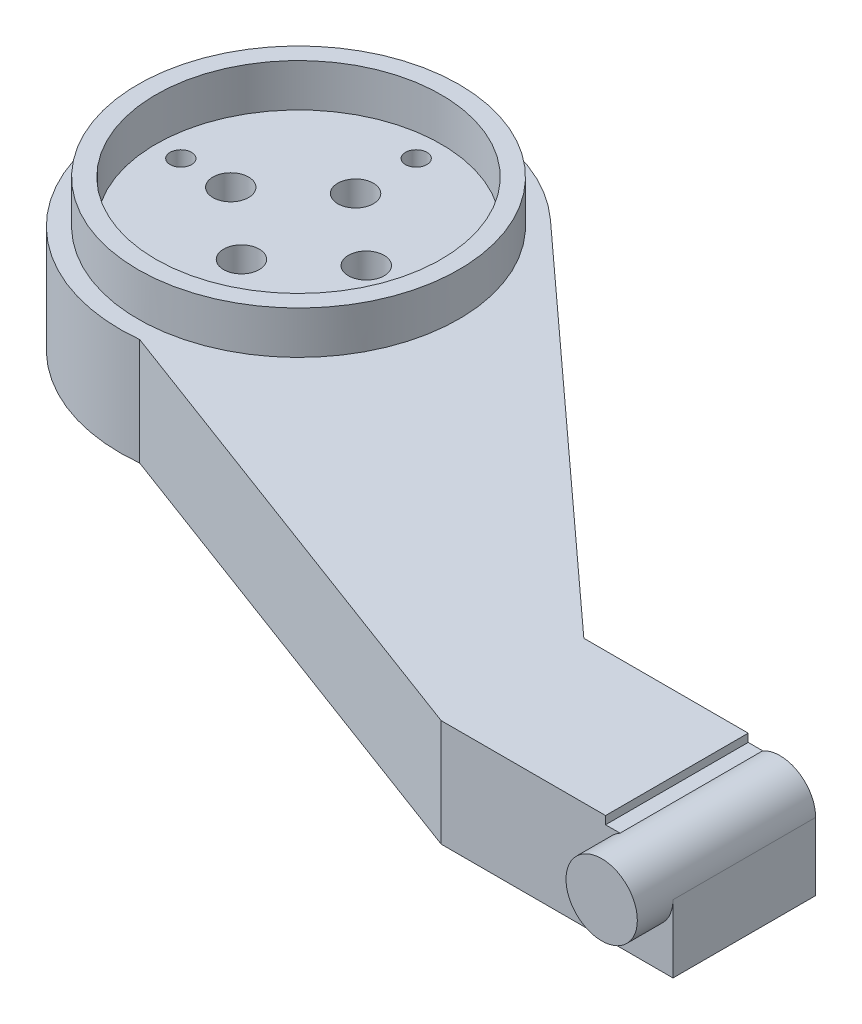
from build123d import *

# Parameters (mm, degrees)
EXTRUDE_1_DEPTH           = 10
EXTRUDE_1_DEPTH_BACK      = 5
SKETCH_1_W                = 35
SKETCH_1_H                = 20
SKETCH_17_R               = 5
EXTRUDE_3_DEPTH           = 5
SKETCH_7_R                = 3
CUT_EXTRUDE_7_DEPTH       = 5
CUT_EXTRUDE_12_DEPTH      = 26.124689053
CUT_EXTRUDE_12_DEPTH_BACK = 26.124689053
EXTRUDE_2_DEPTH           = 15
SKETCH_19_R               = 22.5
SKETCH_19_R_2             = 20
EXTRUDE_4_DEPTH           = 6
SKETCH_20_R               = 2.5
SKETCH_20_R_2             = 1.5
CUT_EXTRUDE_16_DEPTH      = 6


with BuildPart() as part:
    # 草圖1 → 填料-伸長1 (new, two sides: drawn at the far end of the back side and taken through both)
    with BuildSketch(Plane(origin=(0, 0, 0), x_dir=(1, 0, 0), z_dir=(0, 1, 0)).offset(-EXTRUDE_1_DEPTH_BACK)):
        Rectangle(SKETCH_1_W, SKETCH_1_H)
    extrude(amount=EXTRUDE_1_DEPTH + EXTRUDE_1_DEPTH_BACK)

    # 草圖17 → 填料-伸長3 (add)
    with BuildSketch(Plane.XY.offset(10)):
        with Locations((10, 4.5)):
            Circle(SKETCH_17_R)
    extrude(amount=EXTRUDE_3_DEPTH)

    # 草圖7 → 除料-伸長7 (cut, symmetric)
    with BuildSketch(Plane.XY.offset(-10)):
        with Locations((10, 4.5)):
            Circle(SKETCH_7_R)
    extrude(amount=CUT_EXTRUDE_7_DEPTH, both=True, mode=Mode.SUBTRACT)

    # 草圖12 → 除料-伸長12 (cut, two sides: drawn at the far end of the back side and taken through both)
    with BuildSketch(Plane.XY.offset(-CUT_EXTRUDE_12_DEPTH_BACK)):
        with BuildLine():
            Line((15, 4.5), (15, -5))
            Line((15, -5), (17.54652099, -5))
            Line((17.54652099, -5), (17.54652099, 10.497831093))
            Line((17.54652099, 10.497831093), (5.54652099, 10.497831093))
            Line((5.54652099, 10.497831093), (5.54652099, 8.8762607))
            Line((5.54652099, 8.8762607), (7.581665389, 8.8762607))
            ThreePointArc((7.581665389, 8.8762607), (12.540504571, 8.806487725), (15, 4.5))
        make_face()
    extrude(amount=CUT_EXTRUDE_12_DEPTH + CUT_EXTRUDE_12_DEPTH_BACK, mode=Mode.SUBTRACT)

    # 草圖14 → 填料-伸長2 (add)
    with BuildSketch(Plane(origin=(0, -5, 0), x_dir=(1, 0, 0), z_dir=(0, 1, 0))):
        with BuildLine():
            Line((-17.5, 10), (-70.654637132, 58.47251336))
            ThreePointArc((-70.654637132, 58.47251336), (-111.24926813, 47.808473813), (-84.903421397, 15.135210044))
            Line((-84.903421397, 15.135210044), (-17.5, -10))
            Line((-17.5, -10), (-17.5, 10))
        make_face()
    extrude(amount=EXTRUDE_2_DEPTH)

    # 草圖19 → 填料-伸長4 (add)
    with BuildSketch(Plane(origin=(0, 10, 0), x_dir=(1, 0, 0), z_dir=(0, 1, 0))):
        with Locations(Location((-87.5, 40, 0), (0, 0, 90))):
            Circle(SKETCH_19_R)
        with Locations(Location((-87.5, 40, 0), (0, 0, 270))):
            Circle(SKETCH_19_R_2, mode=Mode.SUBTRACT)
    extrude(amount=EXTRUDE_4_DEPTH)

    # 草圖20 → 除料-伸長16 (cut)
    with BuildSketch(Plane(origin=(0, 10, 0), x_dir=(1, 0, 0), z_dir=(0, 1, 0))):
        with Locations(Location((-87.5, 48, 0), (0, 0, 270))):
            Circle(SKETCH_20_R)
        with Locations(Location((-87.5, 56.5, 0), (0, 0, 270))):
            Circle(SKETCH_20_R_2)
        with Locations(Location((-97, 40, 0), (0, 0, 270))):
            Circle(SKETCH_20_R)
        with Locations(Location((-104, 40, 0), (0, 0, 270))):
            Circle(SKETCH_20_R_2)
        with Locations(Location((-87.5, 32, 0), (0, 0, 90))):
            Circle(SKETCH_20_R)
        with Locations(Location((-87.5, 23.5, 0), (0, 0, 90))):
            Circle(SKETCH_20_R_2)
        with Locations(Location((-71, 40, 0), (0, 0, 90))):
            Circle(SKETCH_20_R_2)
        with Locations(Location((-78, 40, 0), (0, 0, 90))):
            Circle(SKETCH_20_R)
    extrude(amount=-CUT_EXTRUDE_16_DEPTH, mode=Mode.SUBTRACT)


solid = part.part
